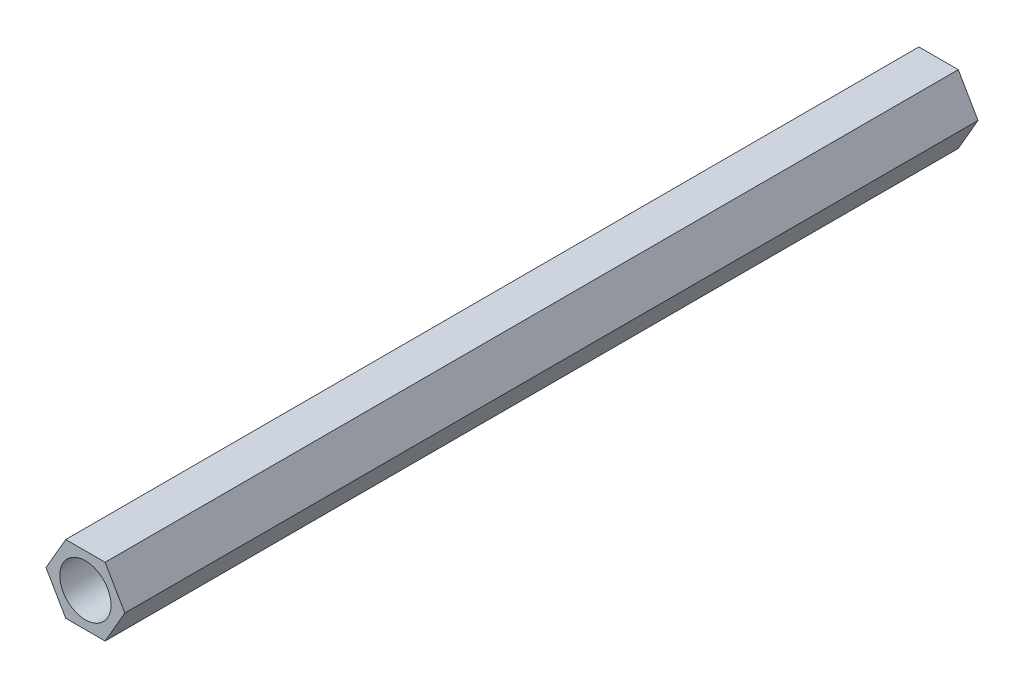
from build123d import *

# Parameters (mm, degrees)
SKETCH_1_R      = 1.5
EXTRUDE_1_DEPTH = 50


with BuildPart() as part:
    # 草图1 → 凸台-拉伸1 (new body)
    with BuildSketch(Plane.XY):
        Polygon((1.154700538, -2), (2.309401077, 0), (1.154700538, 2), (-1.154700538, 2), (-2.309401077, 0), (-1.154700538, -2), align=None)
        Circle(SKETCH_1_R, mode=Mode.SUBTRACT)
    extrude(amount=EXTRUDE_1_DEPTH)


solid = part.part
